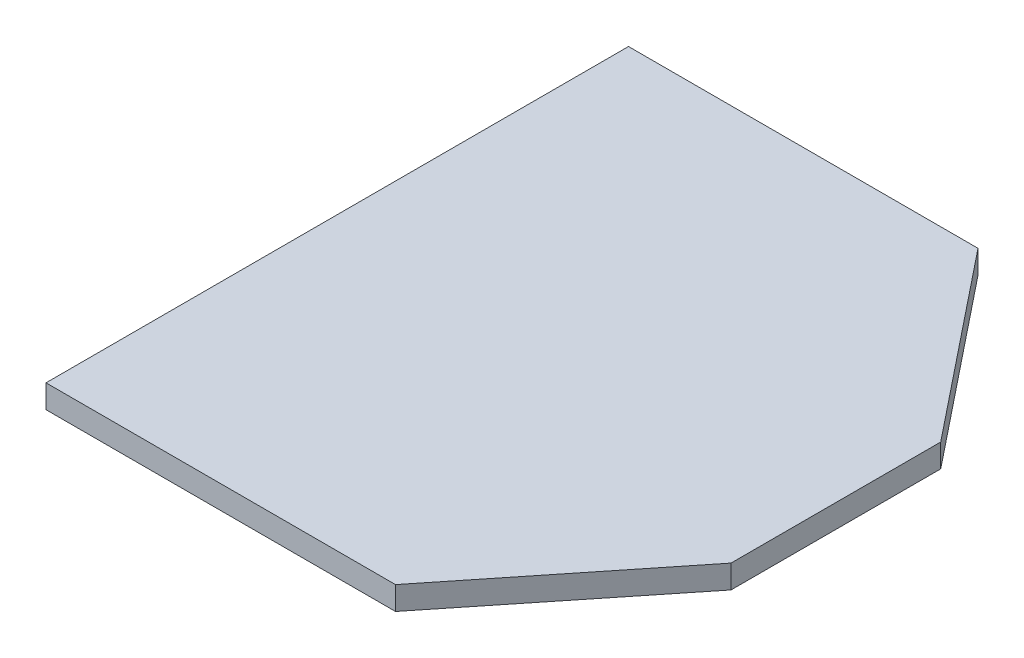
from build123d import *

# Parameters (mm, degrees)
BOSS_EXTRUDE1_DEPTH = 5
SKETCH3_W           = 36
SKETCH3_H           = 90
CUT_EXTRUDE1_DEPTH  = 10


with BuildPart() as part:
    # Sketch1 → Boss-Extrude1 (new, symmetric)
    with BuildSketch(Plane(origin=(0, 0, 0), x_dir=(1, 0, 0), z_dir=(0, 1, 0))):
        Polygon((75, 125), (175, 0), (75, -125), (-75, -125), (-75, 125), align=None)
    extrude(amount=BOSS_EXTRUDE1_DEPTH, both=True)

    # Sketch3 → Cut-Extrude1 (cut)
    with BuildSketch(Plane(origin=(0, 5, 0), x_dir=(1, 0, 0), z_dir=(0, 1, 0))):
        with Locations((157, 0)):
            Rectangle(SKETCH3_W, SKETCH3_H)
    extrude(amount=-CUT_EXTRUDE1_DEPTH, mode=Mode.SUBTRACT)


solid = part.part
